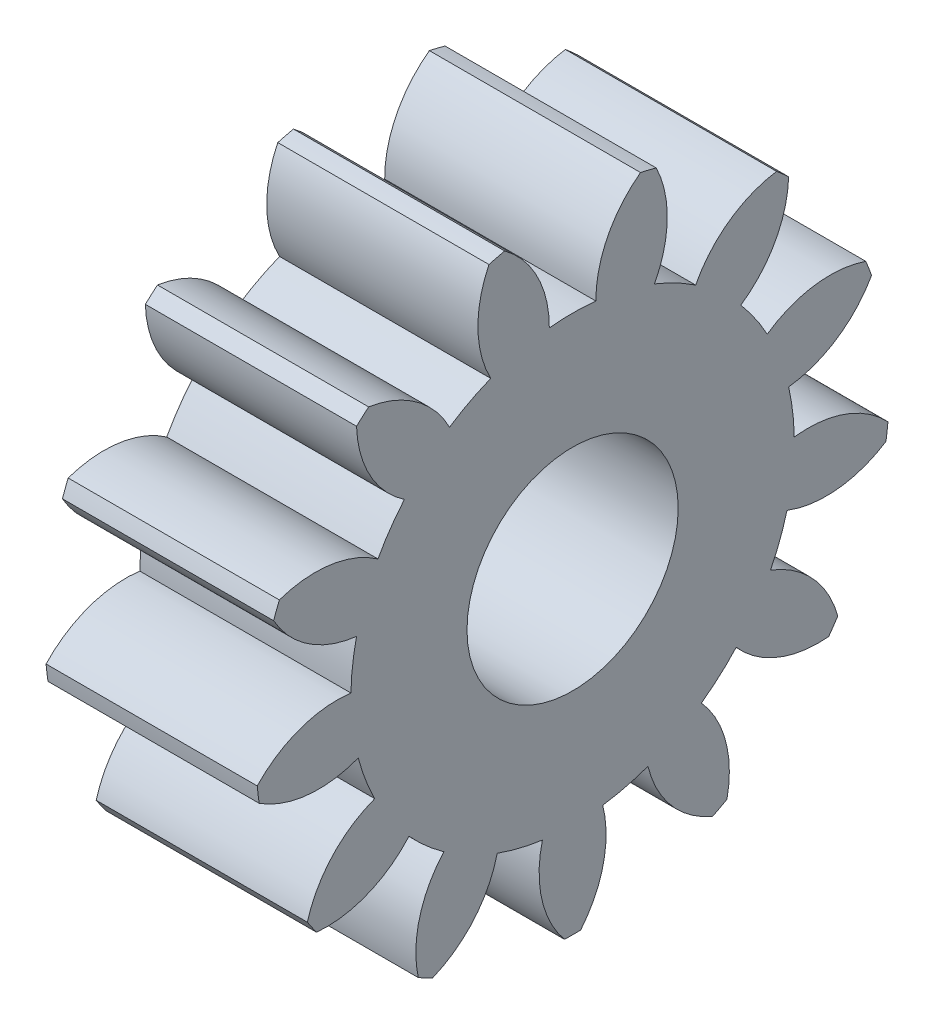
from build123d import *

# Parameters (mm, degrees)
BASPROSKE_W     = 3
BASPROSKE_H     = 4.5
TOOTHCUT_DEPTH  = 8.03562364
TEETHCUTS_COUNT = 13
TEETHCUTS_ANGLE = 332.307692308
BORSKE_R        = 1.5
BORE_DEPTH      = 50.0000508


with BuildPart() as part:
    # BasProSke → Base-Revolve (revolve)
    with BuildSketch(Plane(origin=(0, 0, 0), x_dir=(1, 0, 0), z_dir=(0, 1, 0)), mode=Mode.PRIVATE) as base_revolve_sk:
        with Locations((1.5, 2.25)):
            Rectangle(BASPROSKE_W, BASPROSKE_H)
    revolve(base_revolve_sk.sketch.rotate(Axis((-10, 0, 0), (1, 0, 0)), 180), axis=Axis((-10, 0, 0), (1, 0, 0)))

    # TooCutSke → ToothCut (cut, through all)
    with BuildSketch(Plane(origin=(0, 0, 0), x_dir=(0, 0, -1), z_dir=(1, 0, 0))):
        with BuildLine():
            ThreePointArc((0.330578579, 3.131600039), (0, 3.149), (-0.330578579, 3.131600039))
            ThreePointArc((-0.330578579, 3.131600039), (-0.504119116, 3.854627805), (-0.992642471, 4.415190379))
            ThreePointArc((-0.992642471, 4.415190379), (0, 4.5254), (0.992642471, 4.415190379))
            ThreePointArc((0.992642471, 4.415190379), (0.504119116, 3.854627805), (0.330578579, 3.131600039))
        make_face()
    toothcut = extrude(amount=TOOTHCUT_DEPTH, mode=Mode.SUBTRACT)

    # TeethCuts: ToothCut ×13 about axis
    teethcuts_axis = Axis((-10, 0, 0), (1, 0, 0))
    for i in range(1, TEETHCUTS_COUNT):
        add(toothcut.rotate(teethcuts_axis, i * TEETHCUTS_ANGLE / (TEETHCUTS_COUNT - 1)), mode=Mode.SUBTRACT)

    # BorSke → Bore (cut, symmetric)
    with BuildSketch(Plane(origin=(0, 0, 0), x_dir=(0, 0, -1), z_dir=(1, 0, 0))):
        with Locations(Location((0, 0, 0), (0, 0, 180))):
            Circle(BORSKE_R)
    extrude(amount=BORE_DEPTH, both=True, mode=Mode.SUBTRACT)


solid = part.part
